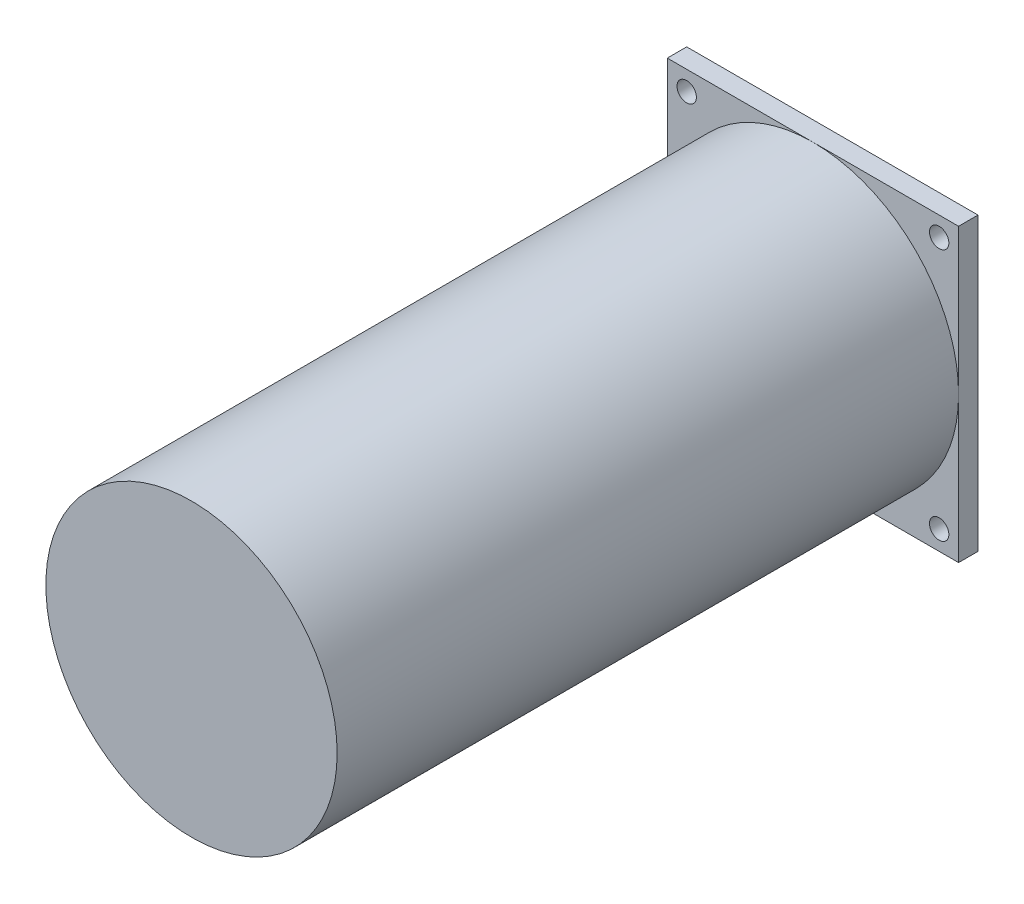
from build123d import *

# Parameters (mm, degrees)
SKIZZE2_W                       = 150
SKIZZE2_H                       = 150
SKIZZE2_R                       = 5
AUFSATZ_LINEAR_AUSTRAGEN1_DEPTH = 10
SKIZZE3_R                       = 75
AUFSATZ_LINEAR_AUSTRAGEN2_DEPTH = 320


with BuildPart() as part:
    # Skizze2 → Aufsatz-Linear austragen1 (new body)
    with BuildSketch(Plane.XY):
        Rectangle(SKIZZE2_W, SKIZZE2_H)
        with Locations((-65, 65)):
            Circle(SKIZZE2_R, mode=Mode.SUBTRACT)
        with Locations((65, 65)):
            Circle(SKIZZE2_R, mode=Mode.SUBTRACT)
        with Locations((65, -65)):
            Circle(SKIZZE2_R, mode=Mode.SUBTRACT)
        with Locations((-65, -65)):
            Circle(SKIZZE2_R, mode=Mode.SUBTRACT)
    extrude(amount=AUFSATZ_LINEAR_AUSTRAGEN1_DEPTH)

    # Skizze3 → Aufsatz-Linear austragen2 (add)
    with BuildSketch(Plane.XY.offset(10)):
        Circle(SKIZZE3_R)
    extrude(amount=AUFSATZ_LINEAR_AUSTRAGEN2_DEPTH)


solid = part.part
